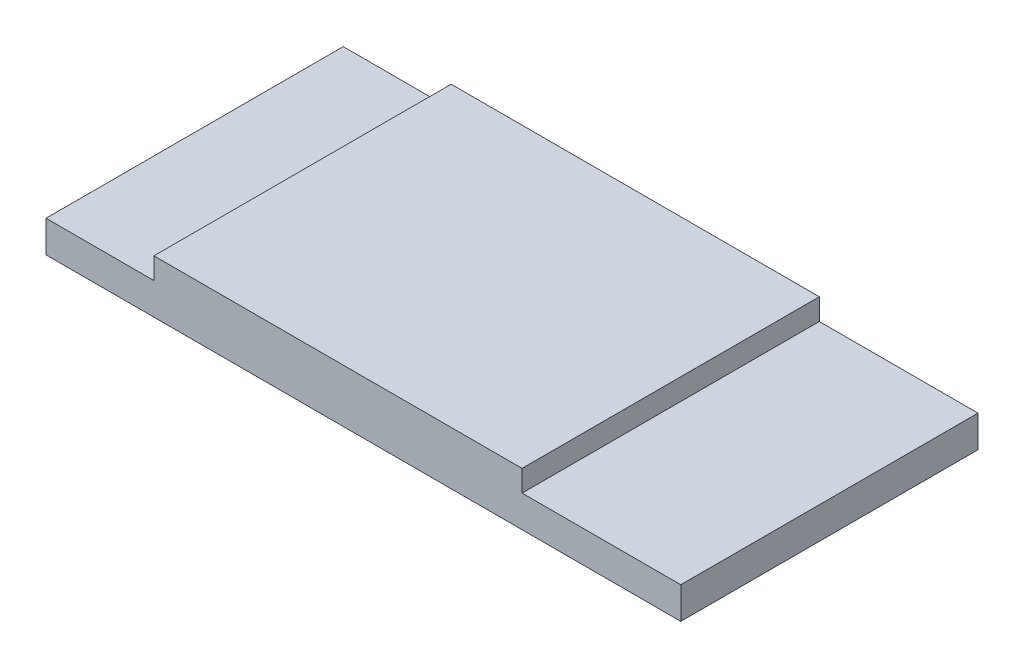
from build123d import *

# Parameters (mm, degrees)
SKETCH1_W           = 40
SKETCH1_H           = 18.73
BOSS_EXTRUDE1_DEPTH = 2
SKETCH2_W           = 23.2
SKETCH2_H           = 18.73
BOSS_EXTRUDE2_DEPTH = 1.35


with BuildPart() as part:
    # Sketch1 → Boss-Extrude1 (new body)
    with BuildSketch(Plane(origin=(0, 0, 0), x_dir=(1, 0, 0), z_dir=(0, 1, 0))):
        with Locations((20, 9.365)):
            Rectangle(SKETCH1_W, SKETCH1_H)
    extrude(amount=BOSS_EXTRUDE1_DEPTH)

    # Sketch2 → Boss-Extrude2 (add)
    with BuildSketch(Plane(origin=(0, 2, 0), x_dir=(1, 0, 0), z_dir=(0, 1, 0))):
        with Locations((18.4, 9.365)):
            Rectangle(SKETCH2_W, SKETCH2_H)
    extrude(amount=BOSS_EXTRUDE2_DEPTH)


solid = part.part
